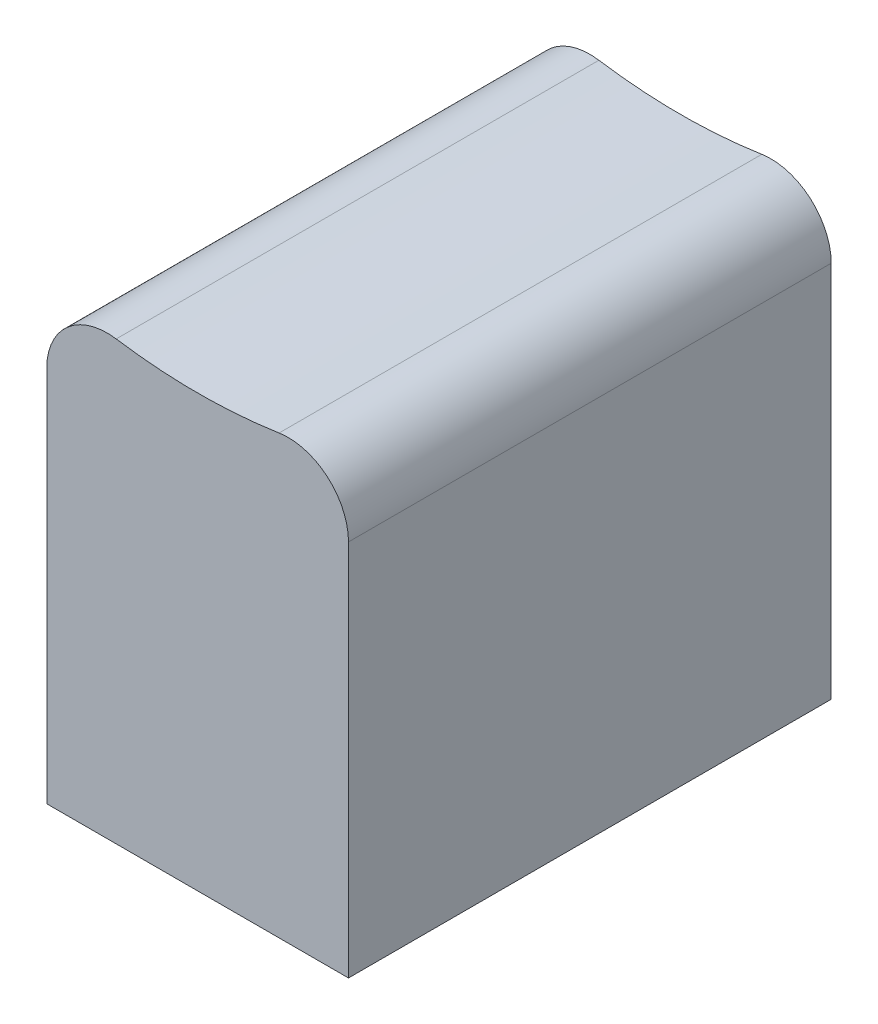
from build123d import *

# Parameters (mm, degrees)
SKETCH2_W           = 10
SKETCH2_H           = 16
BOSS_EXTRUDE1_DEPTH = 15
CUT_EXTRUDE1_DEPTH  = 23.494443758
FILLET1_R           = 2
SKETCH1_W           = 4
SKETCH1_H           = 1.6
CUT_EXTRUDE3_DEPTH  = 12


with BuildPart() as part:
    # Sketch2 → Boss-Extrude1 (new body)
    with BuildSketch(Plane(origin=(0, 0, 0), x_dir=(1, 0, 0), z_dir=(0, 1, 0))):
        Rectangle(SKETCH2_W, SKETCH2_H)
    extrude(amount=BOSS_EXTRUDE1_DEPTH)

    # Sketch4 → Cut-Extrude1 (cut, through all)
    with BuildSketch(Plane(origin=(0, 0, -8), x_dir=(-1, 0, 0), z_dir=(0, 0, -1))):
        with BuildLine():
            Line((5, 15), (-5, 15))
            ThreePointArc((-5, 15), (0, 14.291616466), (5, 15))
        make_face()
    extrude(amount=-CUT_EXTRUDE1_DEPTH, mode=Mode.SUBTRACT)

    # Fillet1
    fillet1_edges = [part.edges().sort_by_distance(p)[0] for p in [
        (5, 15, 0),
        (-5, 15, 0),
    ]]
    fillet(fillet1_edges, radius=FILLET1_R)

    # Sketch1 → Cut-Extrude3 (cut)
    with BuildSketch(Plane(origin=(0, 0, 0), x_dir=(1, 0, 0), z_dir=(0, 1, 0))):
        Rectangle(SKETCH1_W, SKETCH1_H)
    extrude(amount=CUT_EXTRUDE3_DEPTH, mode=Mode.SUBTRACT)


solid = part.part
